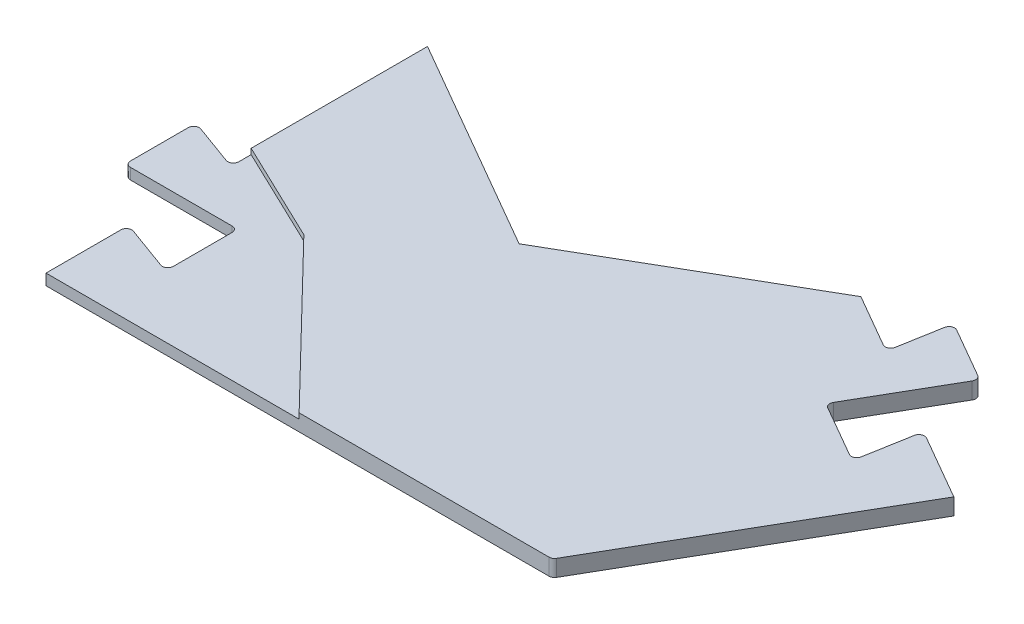
from build123d import *

# Parameters (mm, degrees)
P_IDAT_VYSUNUT_M1_DEPTH = 3
P_IDAT_VYSUNUT_M2_DEPTH = 2
ZAOBLIT1_R              = 1


with BuildPart() as part:
    # Skica1 → Přidat vysunutím1 (new body)
    with BuildSketch(Plane(origin=(0, 0, 0), x_dir=(1, 0, 0), z_dir=(0, 1, 0))):
        Polygon((26.667853432, 46.190077074), (13.677472376, 53.690077074), (11.737150801, 42.685966604), (0.392218012, 49.235966604), (10.61747027, 66.946623035), (-0.554257439, 73.396623035), (-2.393036353, 62.968389614), (-13.22114317, 69.22), (-52.538696502, 46.52), (-91.856249834, 69.22), (-91.856249834, 37.22), (-73.49138407, 28.419769911), (-45.928124917, 0), (0, 0), align=None)
    extrude(amount=P_IDAT_VYSUNUT_M1_DEPTH)

    # Skica1<15> → Přidat vysunutím2 (add)
    with BuildSketch(Plane(origin=(0, 0, 0), x_dir=(1, 0, 0), z_dir=(0, 1, 0))):
        Polygon((-91.856249834, 0), (-45.928124917, 0), (-73.49138407, 28.419769911), (-91.856249834, 37.22), (-91.856249834, 33.55662508), (-101.80675435, 37.17831254), (-101.80675435, 24.27831254), (-81.356249834, 24.27831254), (-81.356249834, 11.17831254), (-91.856249834, 15), align=None)
    extrude(amount=P_IDAT_VYSUNUT_M2_DEPTH)

    # Zaoblit1
    zaoblit1_edges = [part.edges().sort_by_distance(p)[0] for p in [
        (-81.356249834, 1, -11.17831254),
        (-91.856249834, 1, -15),
        (-81.356249834, 1, -24.27831254),
        (-101.80675435, 1, -24.27831254),
        (-101.80675435, 1, -37.17831254),
        (-91.856249834, 1, -33.55662508),
        (0, 1.5, 0),
        (13.677472376, 1.5, -53.690077074),
        (11.737150801, 1.5, -42.685966604),
        (0.392218012, 1.5, -49.235966604),
        (-2.393036353, 1.5, -62.968389614),
        (-0.554257439, 1.5, -73.396623035),
        (10.61747027, 1.5, -66.946623035),
    ]]
    fillet(zaoblit1_edges, radius=ZAOBLIT1_R)


solid = part.part
